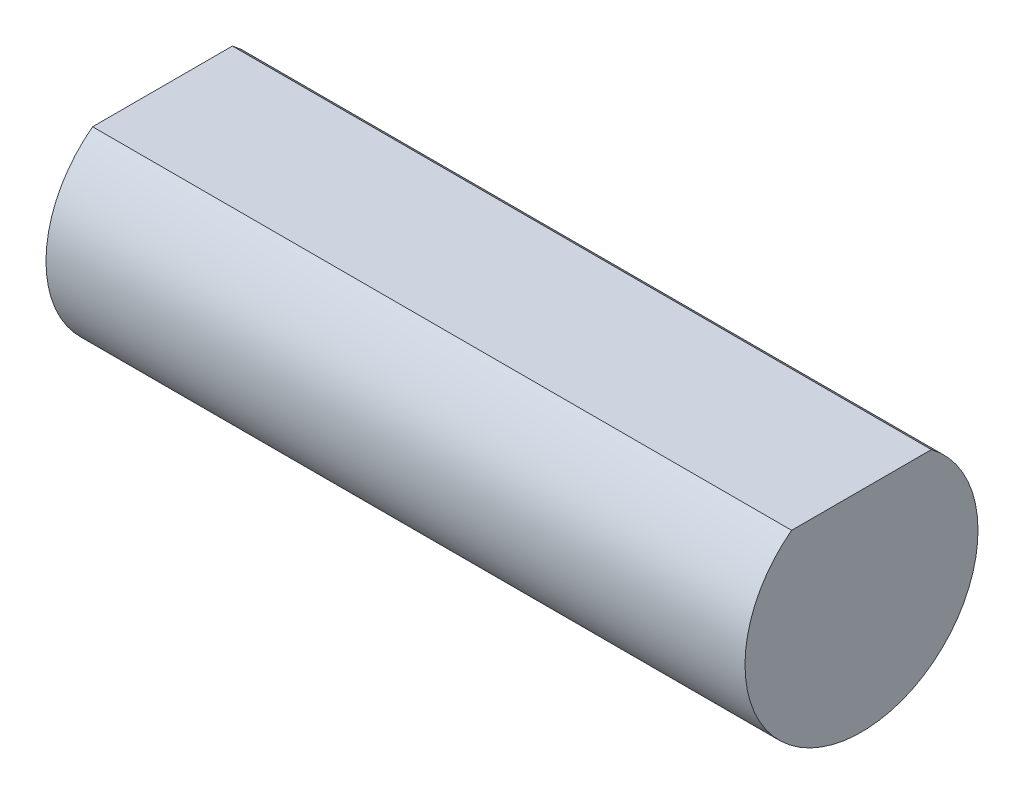
from build123d import *

# Parameters (mm, degrees)
BOSS_EXTRUDE1_DEPTH = 19.05


with BuildPart() as part:
    # Sketch1 → Boss-Extrude1 (new body)
    with BuildSketch(Plane(origin=(0, 0, 0), x_dir=(0, 0, -1), z_dir=(1, 0, 0))):
        with BuildLine():
            Line((1.905, 2.54), (-1.905, 2.54))
            ThreePointArc((-1.905, 2.54), (-1.419903166, -2.839806331), (3.175, 0))
            ThreePointArc((3.175, 0), (2.839806331, 1.419903166), (1.905, 2.54))
        make_face()
    extrude(amount=BOSS_EXTRUDE1_DEPTH)


solid = part.part
